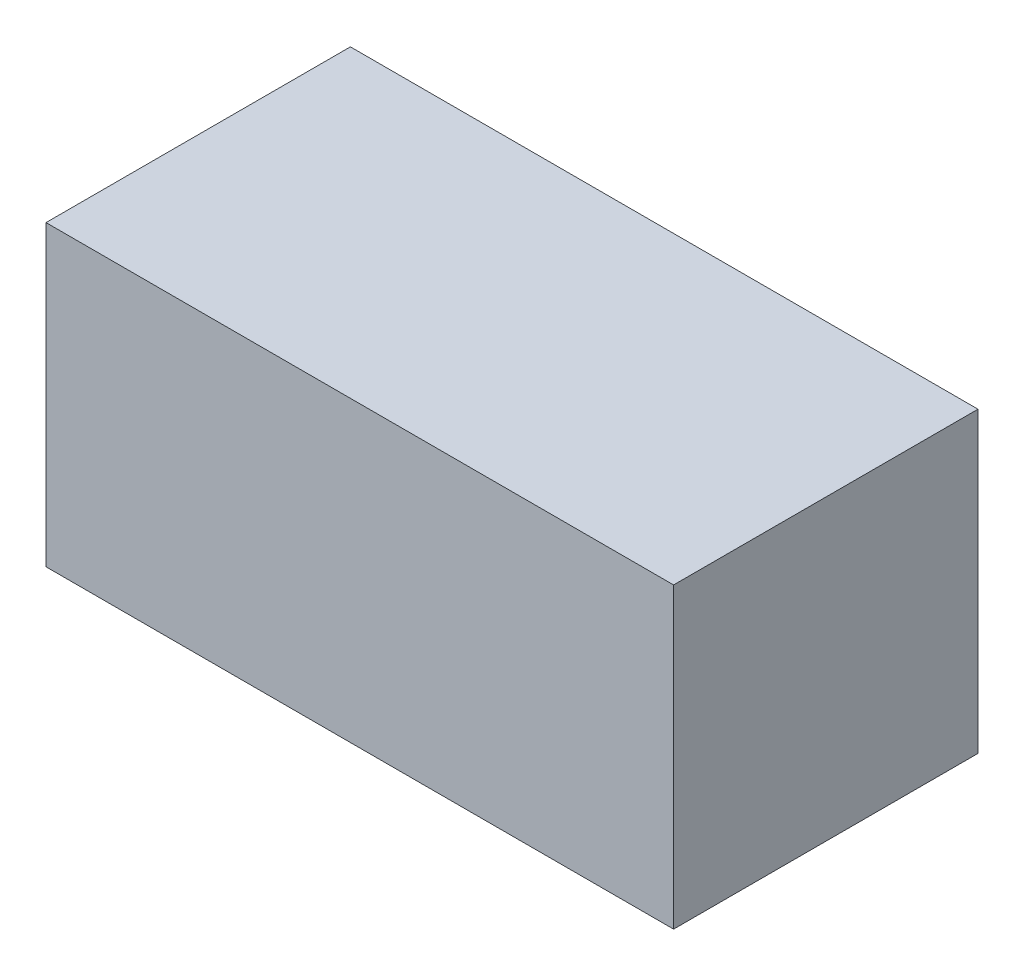
from build123d import *

# Parameters (mm, degrees)
SKETCH1_W           = 200
SKETCH1_H           = 95
BOSS_EXTRUDE1_DEPTH = 97


with BuildPart() as part:
    # Sketch1 → Boss-Extrude1 (new body)
    with BuildSketch(Plane.XY):
        with Locations((100, 47.5)):
            Rectangle(SKETCH1_W, SKETCH1_H)
    extrude(amount=BOSS_EXTRUDE1_DEPTH)


solid = part.part
